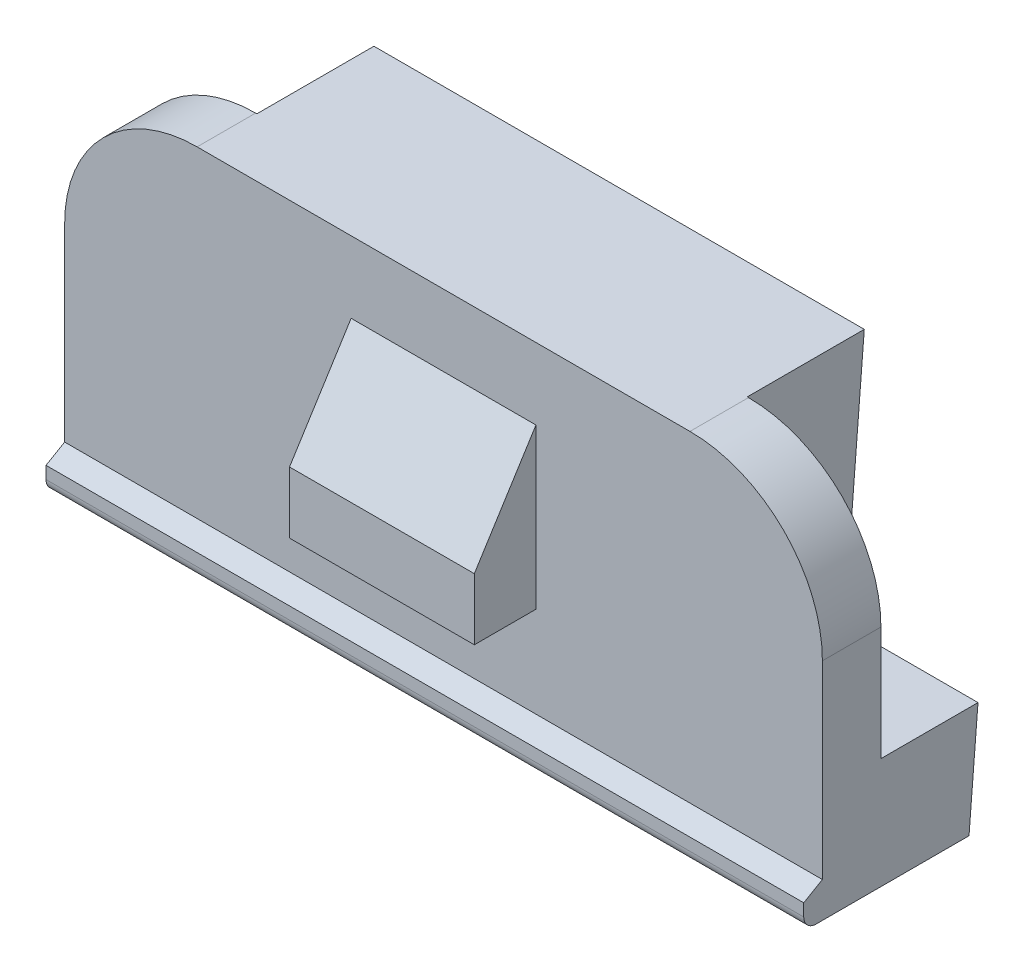
from build123d import *

# Parameters (mm, degrees)
BOSS_EXTRUDE1_DEPTH = 12.3
SKETCH2_W           = 2.17
SKETCH2_H           = 2.05
CUT_EXTRUDE1_DEPTH  = 4
FILLET1_R           = 2.15
SKETCH4_W           = 3
SKETCH4_H           = 1
BOSS_EXTRUDE2_DEPTH = 1
BOSS_EXTRUDE3_DEPTH = 3
CUT_EXTRUDE2_DEPTH  = 14.994303425


with BuildPart() as part:
    # Sketch1 → Boss-Extrude1 (new body)
    with BuildSketch(Plane(origin=(0, 0, 0), x_dir=(0, 0, -1), z_dir=(1, 0, 0))):
        with BuildLine():
            Line((0, 0.2), (0, 0.4))
            Line((0, 0.4), (0.303108891, 0.575))
            Line((0.303108891, 0.575), (0.303108891, 5.8))
            Line((0.303108891, 5.8), (3.303108891, 5.8))
            Line((3.303108891, 5.8), (3.303108891, 0))
            Line((3.303108891, 0), (0.2, 0))
            ThreePointArc((0.2, 0), (0.058578644, 0.058578644), (0, 0.2))
        make_face()
    extrude(amount=BOSS_EXTRUDE1_DEPTH)

    # Sketch2 → Cut-Extrude1 (cut)
    with BuildSketch(Plane(origin=(0, 5.8, 0), x_dir=(1, 0, 0), z_dir=(0, 1, 0))):
        with Locations((1.085, 2.278108891)):
            Rectangle(SKETCH2_W, SKETCH2_H)
        with Locations((11.215, 2.278108891)):
            Rectangle(SKETCH2_W, SKETCH2_H)
    extrude(amount=-CUT_EXTRUDE1_DEPTH, mode=Mode.SUBTRACT)

    # Fillet1
    fillet1_edges = [part.edges().sort_by_distance(p)[0] for p in [
        (0, 5.8, -0.778108891),
        (12.3, 5.8, -0.778108891),
    ]]
    fillet(fillet1_edges, radius=FILLET1_R)

    # Sketch4 → Boss-Extrude2 (add)
    with BuildSketch(Plane.XY.offset(-0.303108891)):
        with Locations((6.15, 2.55)):
            Rectangle(SKETCH4_W, SKETCH4_H)
    extrude(amount=BOSS_EXTRUDE2_DEPTH)

    # Sketch5 → Boss-Extrude3 (add)
    with BuildSketch(Plane(origin=(7.65, 0, 0), x_dir=(0, 0, -1), z_dir=(1, 0, 0))):
        Polygon((-0.696891109, 3.05), (0.303108891, 3.05), (0.303108891, 4.64), align=None)
    extrude(amount=-BOSS_EXTRUDE3_DEPTH)

    # Sketch7 → Cut-Extrude2 (cut, through all)
    with BuildSketch(Plane(origin=(12.3, 0, 0), x_dir=(0, 0, -1), z_dir=(1, 0, 0))):
        Polygon((3.303108891, 5.8), (3.303108891, 0), (2.683108891, 0), (3.153108891, 5.8), align=None)
    extrude(amount=-CUT_EXTRUDE2_DEPTH, mode=Mode.SUBTRACT)


solid = part.part
